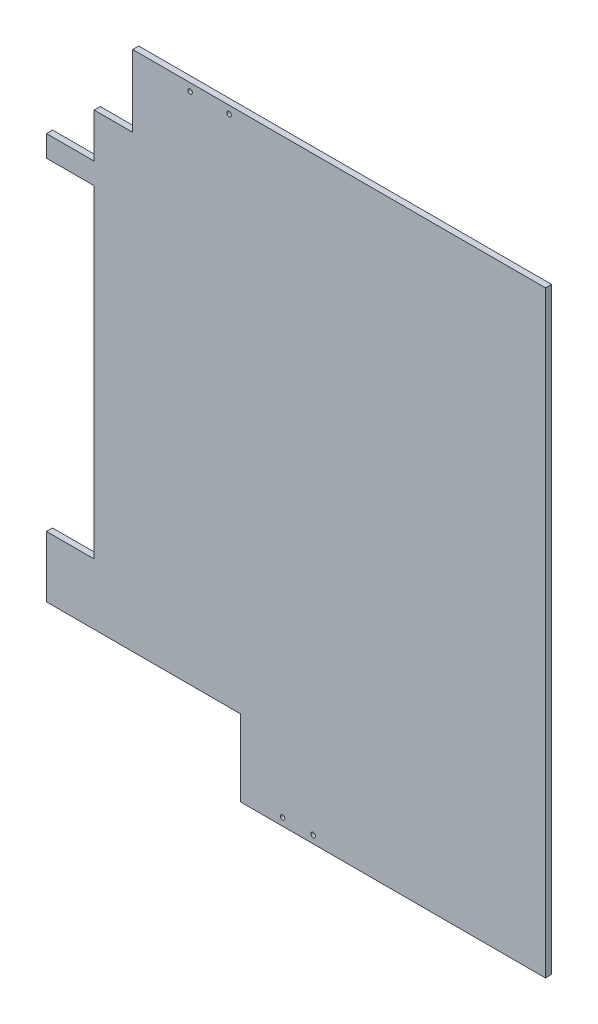
from build123d import *

# Parameters (mm, degrees)
SKETCH1_W           = 31.282297403
SKETCH1_H           = 14
SKETCH1_W_2         = 31.32455923
SKETCH1_H_2         = 40
SKETCH1_W_3         = 270.751882141
SKETCH1_H_3         = 47
SKETCH1_W_4         = 200
SKETCH1_H_4         = 50
BOSS_EXTRUDE1_DEPTH = 4
SKETCH2_R           = 1.5
CUT_EXTRUDE1_DEPTH  = 451.114707602


with BuildPart() as part:
    # Sketch1 → Boss-Extrude1 (new body)
    with BuildSketch(Plane.XY):
        Polygon((25.5, 1), (25.5, -13), (25.5, -225), (25.5, -265), (65.632913627, -265), (121.5, -265), (321.5, -265), (321.5, 30), (50.748117859, 30), (25.5, 30), align=None)
        with Locations((9.858851298, -6)):
            Rectangle(SKETCH1_W, SKETCH1_H)
        with Locations((9.837720385, -245)):
            Rectangle(SKETCH1_W_2, SKETCH1_H_2)
        with Locations((186.124058929, 53.5)):
            Rectangle(SKETCH1_W_3, SKETCH1_H_3)
        with Locations((221.5, -290)):
            Rectangle(SKETCH1_W_4, SKETCH1_H_4)
    extrude(amount=BOSS_EXTRUDE1_DEPTH)

    # Sketch2 → Cut-Extrude1 (cut, through all)
    with BuildSketch(Plane(origin=(0, 0, 0), x_dir=(-1, 0, 0), z_dir=(0, 0, -1))):
        with Locations((-113.998383462, 72)):
            Circle(SKETCH2_R)
        with Locations((-88.397045893, 72)):
            Circle(SKETCH2_R)
        with Locations((-169.168895948, -310)):
            Circle(SKETCH2_R)
        with Locations((-149.084447974, -310)):
            Circle(SKETCH2_R)
    extrude(amount=-CUT_EXTRUDE1_DEPTH, mode=Mode.SUBTRACT)


solid = part.part
